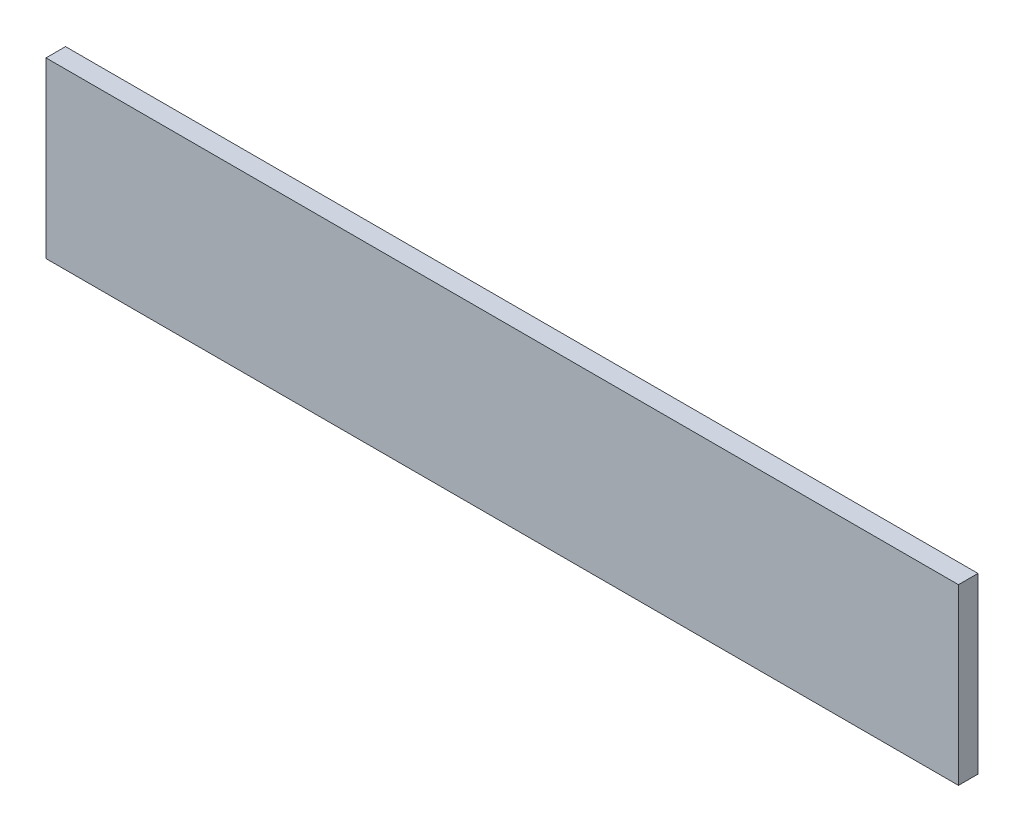
from build123d import *

# Parameters (mm, degrees)
SKETCH1_W           = 296.83
SKETCH1_H           = 56.55
BOSS_EXTRUDE1_DEPTH = 6.35


with BuildPart() as part:
    # Sketch1 → Boss-Extrude1 (new body)
    with BuildSketch(Plane.XY):
        Rectangle(SKETCH1_W, SKETCH1_H)
    extrude(amount=BOSS_EXTRUDE1_DEPTH)


solid = part.part
